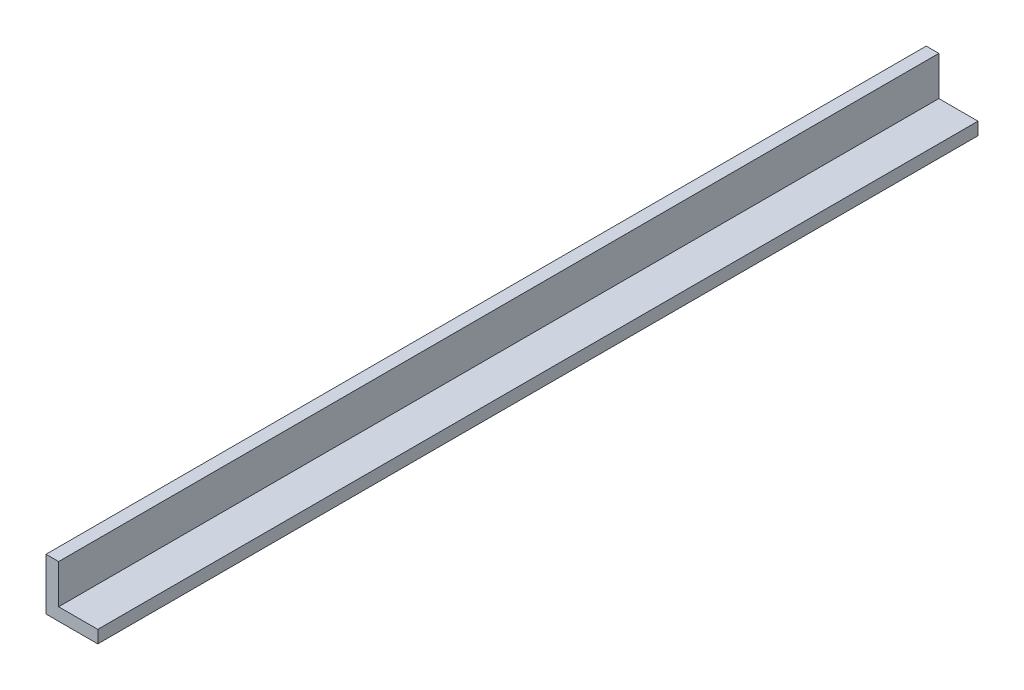
from build123d import *

# Parameters (mm, degrees)
BOSS_EXTRUDE1_DEPTH = 215.9


with BuildPart() as part:
    # Sketch1 → Boss-Extrude1 (new body)
    with BuildSketch(Plane.XY):
        Polygon((0, 0), (12.7, 0), (12.7, 3.0988), (3.0988, 3.0988), (3.0988, 12.7), (0, 12.7), align=None)
    extrude(amount=BOSS_EXTRUDE1_DEPTH)


solid = part.part
